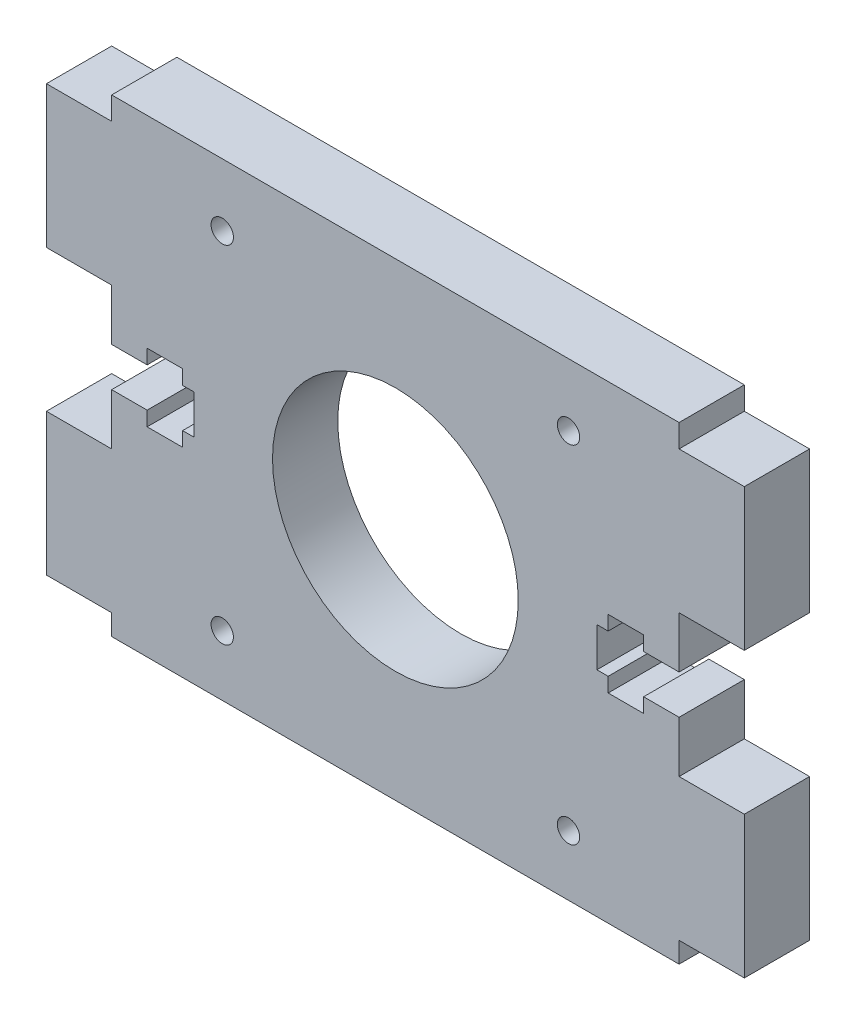
from build123d import *

# Parameters (mm, degrees)
SKETCH1_R           = 1
SKETCH1_R_2         = 11
BOSS_EXTRUDE1_DEPTH = 5.842
CUT_EXTRUDE1_DEPTH  = 39.094507846


with BuildPart() as part:
    # Sketch1 → Boss-Extrude1 (new body)
    with BuildSketch(Plane.XY):
        Polygon((25.4, -21), (-25.4, -21), (-25.4, -19.15), (-31.242, -19.15), (-31.242, -6.45), (-25.4, -6.45), (-25.4, 6.25), (-31.242, 6.25), (-31.242, 18.95), (-25.4, 18.95), (-25.4, 21), (25.4, 21), (25.4, 18.95), (31.242, 18.95), (31.242, 6.25), (25.4, 6.25), (25.4, -6.45), (31.242, -6.45), (31.242, -19.15), (25.4, -19.15), align=None)
        with Locations((-15.5, 15.4)):
            Circle(SKETCH1_R, mode=Mode.SUBTRACT)
        with Locations((15.5, 15.4)):
            Circle(SKETCH1_R, mode=Mode.SUBTRACT)
        with Locations((-15.5, -15.6)):
            Circle(SKETCH1_R, mode=Mode.SUBTRACT)
        with Locations((15.5, -15.6)):
            Circle(SKETCH1_R, mode=Mode.SUBTRACT)
        Circle(SKETCH1_R_2, mode=Mode.SUBTRACT)
    extrude(amount=BOSS_EXTRUDE1_DEPTH)

    # Sketch2 → Cut-Extrude1 (cut, through all)
    with BuildSketch(Plane.XY.offset(5.842)):
        Polygon((-22.225, 1.6526), (-22.225, 2.948), (-19.05, 2.948), (-19.05, 1.6526), (-18.041999984, 1.6526), (-18.041999984, -1.8526), (-19.05, -1.8526), (-19.05, -3.148), (-22.225, -3.148), (-22.225, -1.8526), (-25.4, -1.8526), (-25.4, 1.6526), align=None)
        Polygon((18.041999984, 1.6526), (19.05, 1.6526), (19.05, 2.948), (22.225, 2.948), (22.225, 1.6526), (25.4, 1.6526), (25.4, -1.8526), (22.225, -1.8526), (22.225, -3.148), (19.05, -3.148), (19.05, -1.8526), (18.041999984, -1.8526), align=None)
    extrude(amount=-CUT_EXTRUDE1_DEPTH, mode=Mode.SUBTRACT)


solid = part.part
